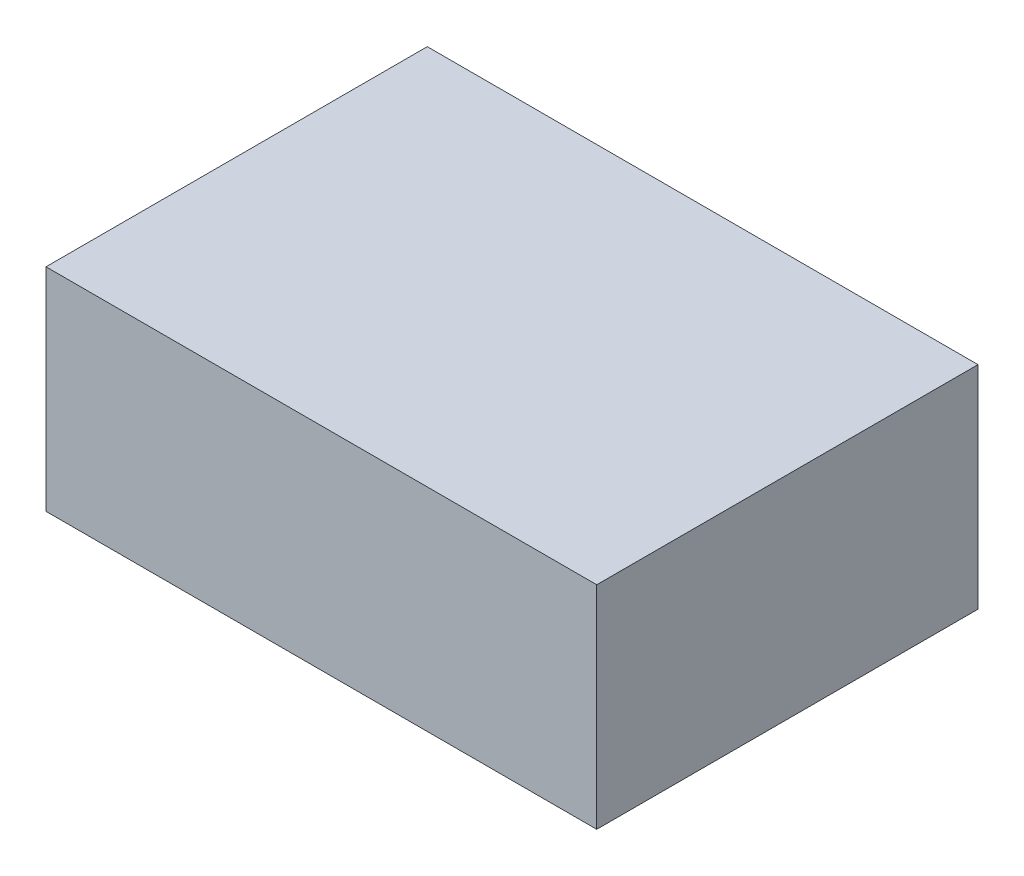
from build123d import *

# Parameters (mm, degrees)
SKETCH_1_W          = 65
SKETCH_1_H          = 45
EXTRUDE_1_DEPTH     = 25
SKETCH_2_R          = 1.5
CUT_EXTRUDE_1_DEPTH = 10


with BuildPart() as part:
    # Эскиз1 → Бобышка-Вытянуть1 (new body)
    with BuildSketch(Plane(origin=(0, 0, 0), x_dir=(1, 0, 0), z_dir=(0, 1, 0))):
        Rectangle(SKETCH_1_W, SKETCH_1_H)
    extrude(amount=EXTRUDE_1_DEPTH)

    # Эскиз2 → Вырез-Вытянуть1 (cut)
    with BuildSketch(Plane.XZ):
        with Locations(Location((-29.5, 13.5, 0), (0, 0, 270))):
            Circle(SKETCH_2_R)
        with Locations(Location((29.5, 13.5, 0), (0, 0, 270))):
            Circle(SKETCH_2_R)
        with Locations(Location((-29.5, -13.5, 0), (0, 0, 270))):
            Circle(SKETCH_2_R)
        with Locations(Location((29.5, -13.5, 0), (0, 0, 270))):
            Circle(SKETCH_2_R)
    extrude(amount=-CUT_EXTRUDE_1_DEPTH, mode=Mode.SUBTRACT)


solid = part.part
